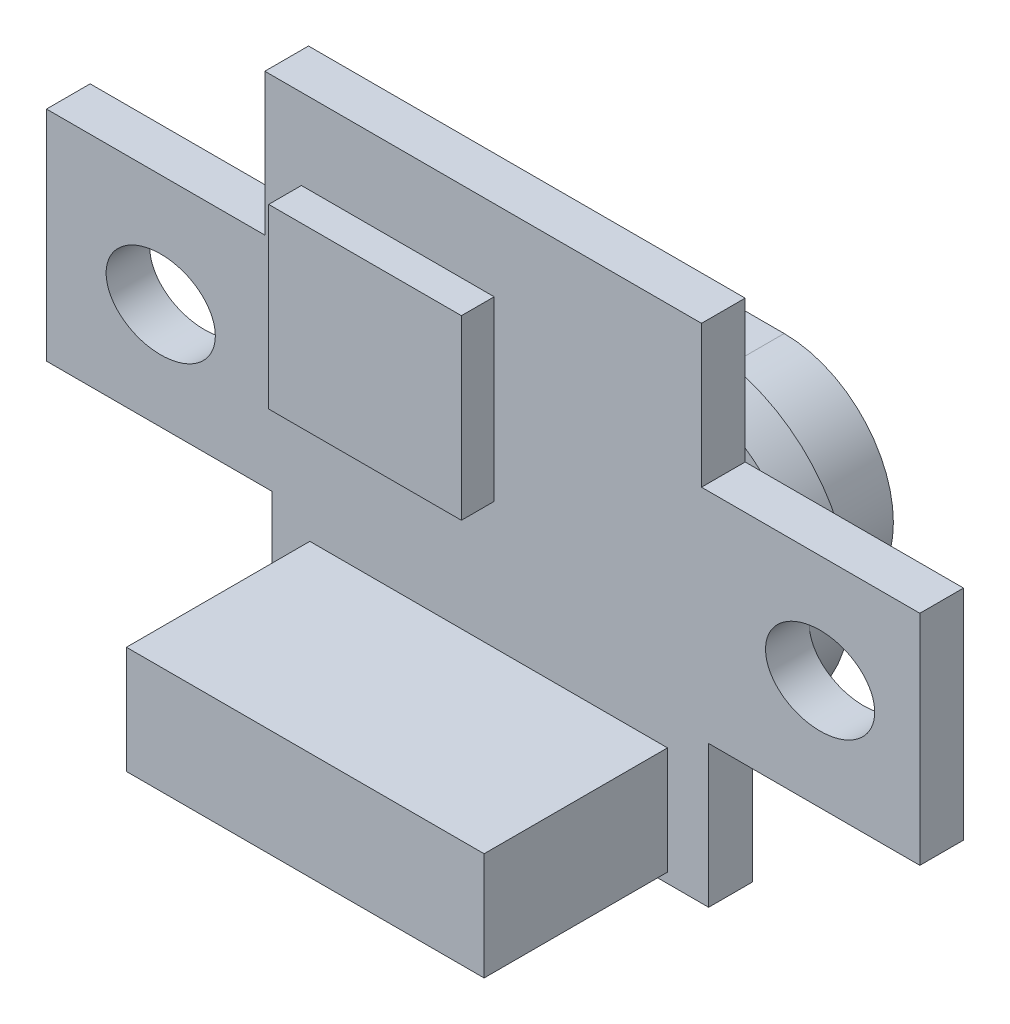
from build123d import *

# Parameters (mm, degrees)
BOSS_EXTRUDE1_DEPTH = 1
SKETCH2_RX          = 1.25
SKETCH2_RY          = 1
CUT_EXTRUDE1_DEPTH  = 15.62450684
BOSS_EXTRUDE2_DEPTH = 0.95
BOSS_EXTRUDE3_DEPTH = 2.1
SKETCH7_W           = 8.190854722
SKETCH7_H           = 2.464294839
BOSS_EXTRUDE4_DEPTH = 4.2
SKETCH8_W           = 4.413735787
SKETCH8_H           = 4.058267134
BOSS_EXTRUDE5_DEPTH = 0.75


with BuildPart() as part:
    # Sketch1 → Boss-Extrude1 (new body)
    with BuildSketch(Plane.XY):
        Polygon((-2.780385667, 3.527721413), (7.219614333, 3.527721413), (7.219614333, 0.277721413), (12.219614333, 0.277721413), (12.219614333, -4.722278587), (7.383278363, -4.722278587), (7.383278363, -7.972278587), (-2.616721637, -7.972278587), (-2.616721637, -4.722278587), (-7.780385667, -4.722278587), (-7.780385667, 0.277721413), (-2.780385667, 0.277721413), align=None)
    extrude(amount=BOSS_EXTRUDE1_DEPTH)

    # Sketch2 → Cut-Extrude1 (cut, through all)
    with BuildSketch(Plane.XY.offset(1)):
        with Locations((9.935757543, -2.200550618)):
            Ellipse(SKETCH2_RX, SKETCH2_RY)
        with Locations(Location((-5.164242457, -2.289417781), (0, 0, 0))):
            Ellipse(SKETCH2_RX, SKETCH2_RY)
    extrude(amount=-CUT_EXTRUDE1_DEPTH, mode=Mode.SUBTRACT)

    # Sketch5 → Boss-Extrude2 (add)
    with BuildSketch(Plane(origin=(0, 0, 0), x_dir=(-1, 0, 0), z_dir=(0, 0, -1))):
        with BuildLine():
            Line((-5.285531474, 1.157258951), (0.514468526, 1.157258951))
            ThreePointArc((0.514468526, 1.157258951), (3.914468526, -2.242741049), (0.514468526, -5.642741049))
            Line((0.514468526, -5.642741049), (-5.285531474, -5.642741049))
            ThreePointArc((-5.285531474, -5.642741049), (-8.685531474, -2.242741049), (-5.285531474, 1.157258951))
        make_face()
    extrude(amount=BOSS_EXTRUDE2_DEPTH)

    # Sketch6 → Boss-Extrude3 (add)
    with BuildSketch(Plane(origin=(0, 0, -0.95), x_dir=(-1, 0, 0), z_dir=(0, 0, -1))):
        with BuildLine():
            Line((-5.063363565, 0.222790462), (0.505645348, 0.222790462))
            ThreePointArc((0.505645348, 0.222790462), (3.005645348, -2.277209538), (0.505645348, -4.777209538))
            Line((0.505645348, -4.777209538), (-5.063363565, -4.777209538))
            ThreePointArc((-5.063363565, -4.777209538), (-7.563363565, -2.277209538), (-5.063363565, 0.222790462))
        make_face()
    extrude(amount=BOSS_EXTRUDE3_DEPTH)

    # Sketch7 → Boss-Extrude4 (add)
    with BuildSketch(Plane.XY.offset(1)):
        with Locations((2.345641724, -6.512937551)):
            Rectangle(SKETCH7_W, SKETCH7_H)
    extrude(amount=BOSS_EXTRUDE4_DEPTH)

    # Sketch8 → Boss-Extrude5 (add)
    with BuildSketch(Plane.XY.offset(1)):
        with Locations((0.264536736, -0.348662557)):
            Rectangle(SKETCH8_W, SKETCH8_H)
    extrude(amount=BOSS_EXTRUDE5_DEPTH)


solid = part.part
